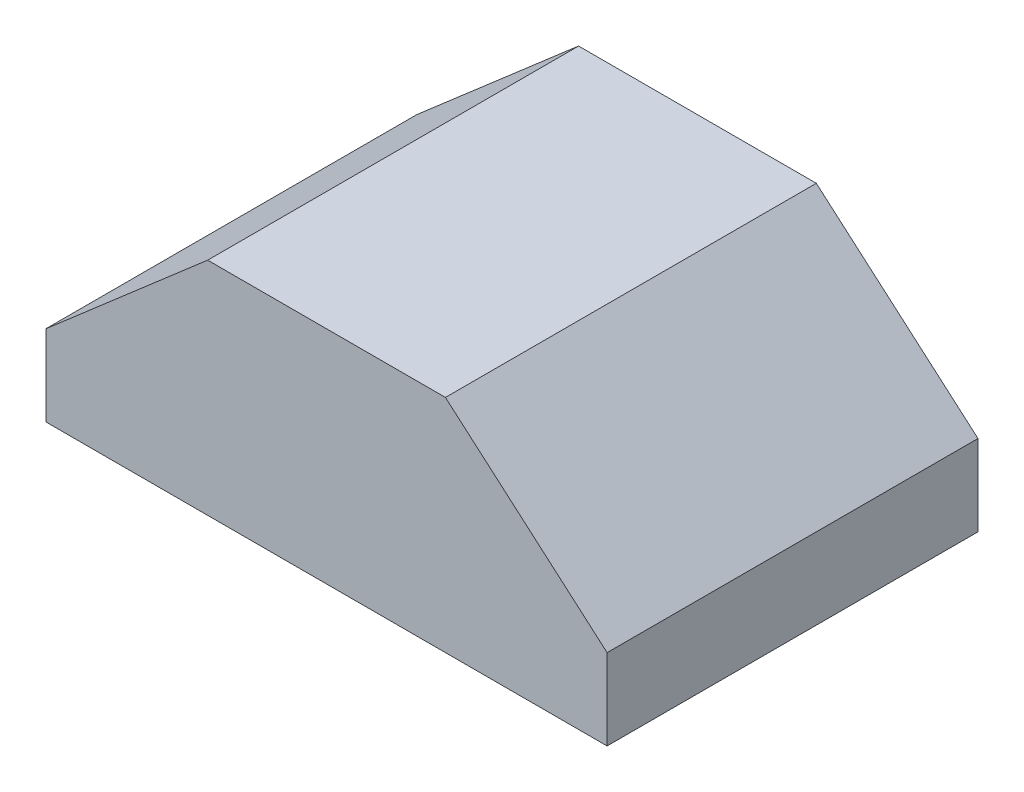
from build123d import *

# Parameters (mm, degrees)
BOSS_EXTRU_1_DEPTH = 3900


with BuildPart() as part:
    # Esquisse1 → Boss.-Extru.1 (new body)
    with BuildSketch(Plane.XY):
        Polygon((-1250, 2323.940297298), (1250, 2323.940297298), (2950, 850), (2950, 0), (-2950, 0), (-2950, 850), align=None)
    extrude(amount=BOSS_EXTRU_1_DEPTH)


solid = part.part
